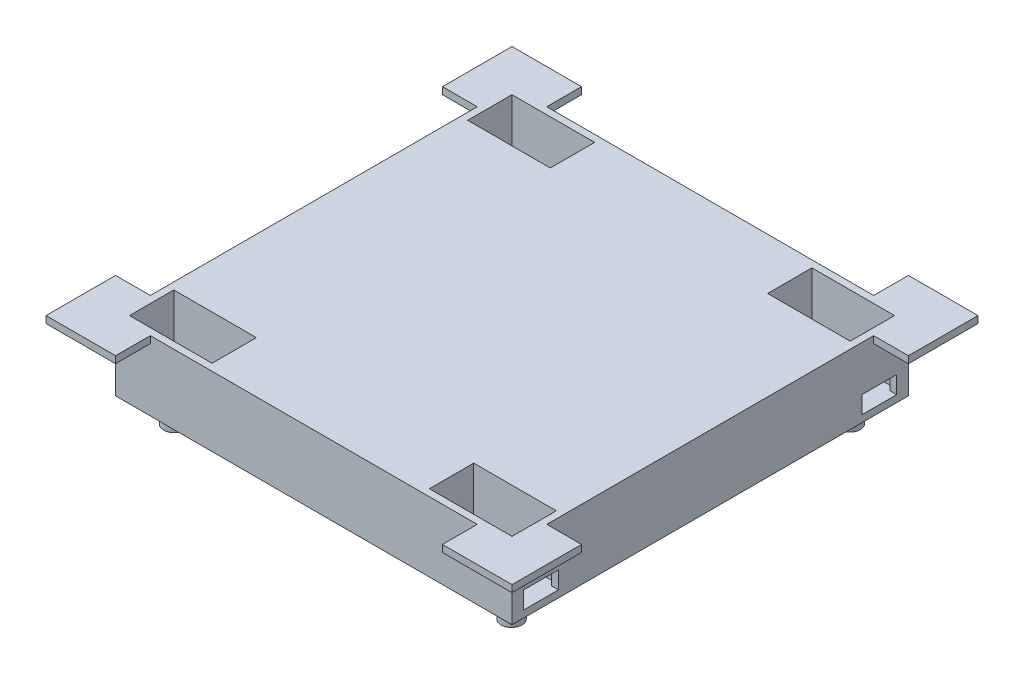
from build123d import *

# Parameters (mm, degrees)
BOSS_EXTRUDE1_DEPTH      = 2
BOSS_EXTRUDE1_DEPTH_BACK = 3
SKETCH1_W                = 120
SKETCH1_H                = 120
SKETCH3_W                = 27.75
SKETCH3_H                = 16.75
BOSS_EXTRUDE4_DEPTH      = 18
SKETCH4_W                = 23.75
SKETCH4_H                = 12.75
CUT_EXTRUDE1_DEPTH       = 18
SKETCH5_R                = 3
BOSS_EXTRUDE5_DEPTH      = 7
SKETCH6_W                = 10
SKETCH6_H                = 5
CUT_EXTRUDE2_DEPTH       = 2
SKETCH7_W                = 10
SKETCH7_H                = 5
CUT_EXTRUDE3_DEPTH       = 2
BOSS_EXTRUDE6_REACH      = 112.411
BOSS_EXTRUDE7_REACH      = 121.478
SKETCH12_W               = 120
SKETCH12_H               = 5
CUT_EXTRUDE4_DEPTH       = 3
SKETCH13_W               = 120
SKETCH13_H               = 5
CUT_EXTRUDE5_DEPTH       = 3
SKETCH14_W               = 114
SKETCH14_H               = 5
CUT_EXTRUDE6_DEPTH       = 3
SKETCH15_W               = 114
SKETCH15_H               = 5
CUT_EXTRUDE7_DEPTH       = 3
BOSS_EXTRUDE8_DEPTH      = 2


with BuildPart() as part:
    # Sketch1 → Boss-Extrude1 (new, two sides: drawn at the far end of the back side and taken through both)
    with BuildSketch(Plane(origin=(0, 0, 0), x_dir=(1, 0, 0), z_dir=(0, 1, 0)).offset(-BOSS_EXTRUDE1_DEPTH_BACK)):
        Rectangle(SKETCH1_W, SKETCH1_H)
    extrude(amount=BOSS_EXTRUDE1_DEPTH + BOSS_EXTRUDE1_DEPTH_BACK)

    # Sketch3 → Boss-Extrude4 (add)
    with BuildSketch(Plane(origin=(0, 0, 0), x_dir=(1, 0, 0), z_dir=(0, 1, 0))):
        with Locations((-43.125, -48.625)):
            Rectangle(SKETCH3_W, SKETCH3_H)
        with Locations((43.125, -48.625)):
            Rectangle(SKETCH3_W, SKETCH3_H)
        with Locations((43.125, 48.625)):
            Rectangle(SKETCH3_W, SKETCH3_H)
        with Locations((-43.125, 48.625)):
            Rectangle(SKETCH3_W, SKETCH3_H)
    extrude(amount=-BOSS_EXTRUDE4_DEPTH)

    # Sketch4 → Cut-Extrude1 (cut)
    with BuildSketch(Plane(origin=(0, 2, 0), x_dir=(1, 0, 0), z_dir=(0, 1, 0))):
        with Locations((-43.125, -48.625)):
            Rectangle(SKETCH4_W, SKETCH4_H)
        with Locations((43.125, -48.625)):
            Rectangle(SKETCH4_W, SKETCH4_H)
        with Locations((43.125, 48.625)):
            Rectangle(SKETCH4_W, SKETCH4_H)
        with Locations((-43.125, 48.625)):
            Rectangle(SKETCH4_W, SKETCH4_H)
    extrude(amount=-CUT_EXTRUDE1_DEPTH, mode=Mode.SUBTRACT)

    # Sketch5 → Boss-Extrude5 (add)
    with BuildSketch(Plane(origin=(0, -18, 0), x_dir=(-1, 0, 0), z_dir=(0, -1, 0))):
        with Locations(Location((48.5, -48.625, 0), (0, 0, 90))):
            Circle(SKETCH5_R)
        with Locations(Location((-48.5, -48.625, 0), (0, 0, 270))):
            Circle(SKETCH5_R)
        with Locations(Location((48.5, 48.625, 0), (0, 0, 270))):
            Circle(SKETCH5_R)
        with Locations(Location((-48.5, 48.625, 0), (0, 0, 270))):
            Circle(SKETCH5_R)
    extrude(amount=BOSS_EXTRUDE5_DEPTH)

    # Sketch6 → Cut-Extrude2 (cut)
    with BuildSketch(Plane(origin=(57, 0, 0), x_dir=(0, 0, -1), z_dir=(1, 0, 0))):
        with Locations((-48.625, -13.5)):
            Rectangle(SKETCH6_W, SKETCH6_H)
        with Locations((48.625, -13.5)):
            Rectangle(SKETCH6_W, SKETCH6_H)
    extrude(amount=-CUT_EXTRUDE2_DEPTH, mode=Mode.SUBTRACT)

    # Sketch7 → Cut-Extrude3 (cut)
    with BuildSketch(Plane.ZY.offset(57)):
        with Locations((48.625, -13.5)):
            Rectangle(SKETCH7_W, SKETCH7_H)
        with Locations((-48.625, -13.5)):
            Rectangle(SKETCH7_W, SKETCH7_H)
    extrude(amount=-CUT_EXTRUDE3_DEPTH, mode=Mode.SUBTRACT)

    # Sketch9 → Boss-Extrude6 (add, up to next)
    with BuildSketch(Plane(origin=(-29.25, 0, 0), x_dir=(0, 0, -1), z_dir=(1, 0, 0)), mode=Mode.PRIVATE) as boss_extrude6_sk1:
        Polygon((57, -3), (55, -3), (56.5, -18), (57, -18), align=None)
    boss_extrude6_tool1 = extrude(boss_extrude6_sk1.sketch, amount=BOSS_EXTRUDE6_REACH, mode=Mode.PRIVATE) - part.part
    # Sketch9 → Boss-Extrude6 (add, up to next)
    with BuildSketch(Plane(origin=(-29.25, 0, 0), x_dir=(0, 0, -1), z_dir=(1, 0, 0)), mode=Mode.PRIVATE) as boss_extrude6_sk2:
        Polygon((-56.5, -18), (-55, -3), (-57, -3), (-57, -18), align=None)
    boss_extrude6_tool2 = extrude(boss_extrude6_sk2.sketch, amount=BOSS_EXTRUDE6_REACH, mode=Mode.PRIVATE) - part.part
    add(boss_extrude6_tool1.solids().sort_by_distance((-29.25, -9, -56.3))[0])
    add(boss_extrude6_tool2.solids().sort_by_distance((-29.25, -9, 56.3))[0])

    # Sketch10 → Boss-Extrude7 (add, up to next)
    with BuildSketch(Plane.XY.offset(-40.25), mode=Mode.PRIVATE) as boss_extrude7_sk1:
        Polygon((-57, -3), (-54, -3), (-56.5, -18), (-57, -18), align=None)
    boss_extrude7_tool1 = extrude(boss_extrude7_sk1.sketch, amount=BOSS_EXTRUDE7_REACH, mode=Mode.PRIVATE) - part.part
    # Sketch10 → Boss-Extrude7 (add, up to next)
    with BuildSketch(Plane.XY.offset(-40.25), mode=Mode.PRIVATE) as boss_extrude7_sk2:
        Polygon((54, -3), (56.5, -18), (57, -18), (57, -3), align=None)
    boss_extrude7_tool2 = extrude(boss_extrude7_sk2.sketch, amount=BOSS_EXTRUDE7_REACH, mode=Mode.PRIVATE) - part.part
    add(boss_extrude7_tool1.solids().sort_by_distance((-55.97619, -8.714286, -40.25))[0])
    add(boss_extrude7_tool2.solids().sort_by_distance((55.97619, -8.714286, -40.25))[0])

    # Sketch12 → Cut-Extrude4 (cut)
    with BuildSketch(Plane.XY.offset(60)):
        with Locations((0, -0.5)):
            Rectangle(SKETCH12_W, SKETCH12_H)
    extrude(amount=-CUT_EXTRUDE4_DEPTH, mode=Mode.SUBTRACT)

    # Sketch13 → Cut-Extrude5 (cut)
    with BuildSketch(Plane(origin=(0, 0, -60), x_dir=(-1, 0, 0), z_dir=(0, 0, -1))):
        with Locations((0, -0.5)):
            Rectangle(SKETCH13_W, SKETCH13_H)
    extrude(amount=-CUT_EXTRUDE5_DEPTH, mode=Mode.SUBTRACT)

    # Sketch14 → Cut-Extrude6 (cut)
    with BuildSketch(Plane.ZY.offset(60)):
        with Locations((0, -0.5)):
            Rectangle(SKETCH14_W, SKETCH14_H)
    extrude(amount=-CUT_EXTRUDE6_DEPTH, mode=Mode.SUBTRACT)

    # Sketch15 → Cut-Extrude7 (cut)
    with BuildSketch(Plane(origin=(60, 0, 0), x_dir=(0, 0, -1), z_dir=(1, 0, 0))):
        with Locations((0, -0.5)):
            Rectangle(SKETCH15_W, SKETCH15_H)
    extrude(amount=-CUT_EXTRUDE7_DEPTH, mode=Mode.SUBTRACT)

    # Sketch16 → Boss-Extrude8 (add)
    with BuildSketch(Plane(origin=(0, 0, 0), x_dir=(1, 0, 0), z_dir=(0, 1, 0))):
        Polygon((-57, 47), (-67, 47), (-67, 67), (-47, 67), (-47, 57), (-57, 57), align=None)
        Polygon((57, 47), (57, 57), (47, 57), (47, 67), (67, 67), (67, 47), align=None)
        Polygon((67, -67), (47, -67), (47, -57), (57, -57), (57, -47), (67, -47), align=None)
        Polygon((-57, -57), (-47, -57), (-47, -67), (-67, -67), (-67, -47), (-57, -47), align=None)
    extrude(amount=BOSS_EXTRUDE8_DEPTH)


solid = part.part
